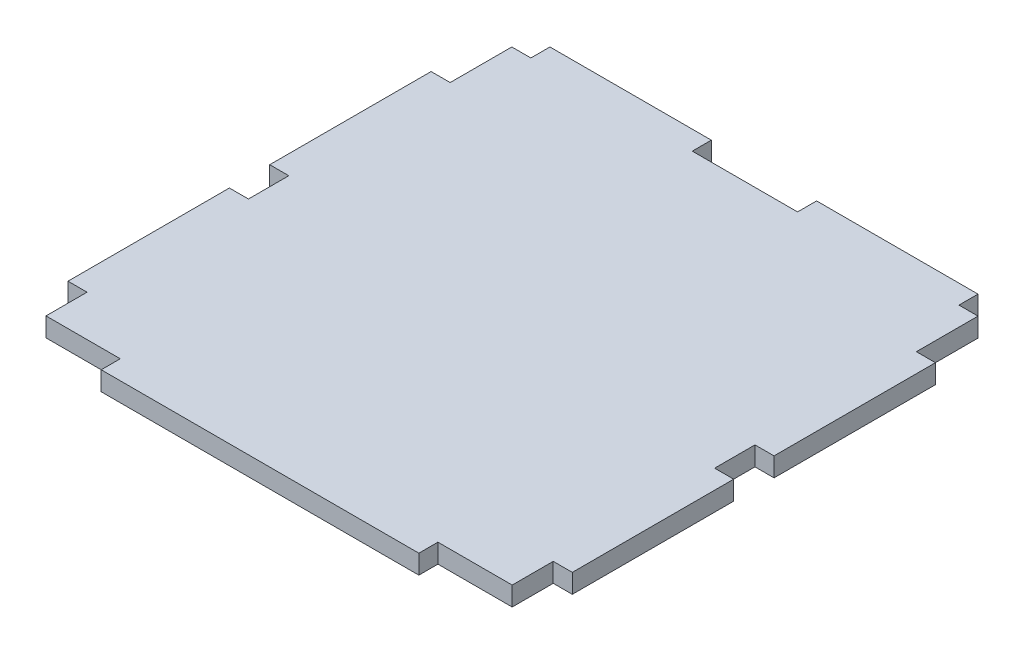
from build123d import *

# Parameters (mm, degrees)
BOSS_EXTRUDE1_DEPTH = 3


with BuildPart() as part:
    # Sketch1 → Boss-Extrude1 (new body)
    with BuildSketch(Plane(origin=(0, 0, 0), x_dir=(1, 0, 0), z_dir=(0, 1, 0))):
        Polygon((-24.995, -38.155), (24.995, -38.155), (24.995, -35.155), (36.685, -35.155), (36.685, -28.695), (39.685, -28.695), (39.685, -3.295), (36.685, -3.295), (36.685, 3.055), (39.685, 3.055), (39.685, 28.455), (36.685, 28.455), (36.685, 38.155), (33.685, 38.155), (33.685, 41.155), (8.285, 41.155), (8.285, 38.155), (-8.285, 38.155), (-8.285, 41.155), (-33.685, 41.155), (-33.685, 38.155), (-36.685, 38.155), (-36.685, 28.455), (-39.685, 28.455), (-39.685, 3.055), (-36.685, 3.055), (-36.685, -3.295), (-39.685, -3.295), (-39.685, -28.695), (-36.685, -28.695), (-36.685, -35.155), (-24.995, -35.155), align=None)
    extrude(amount=BOSS_EXTRUDE1_DEPTH)


solid = part.part
